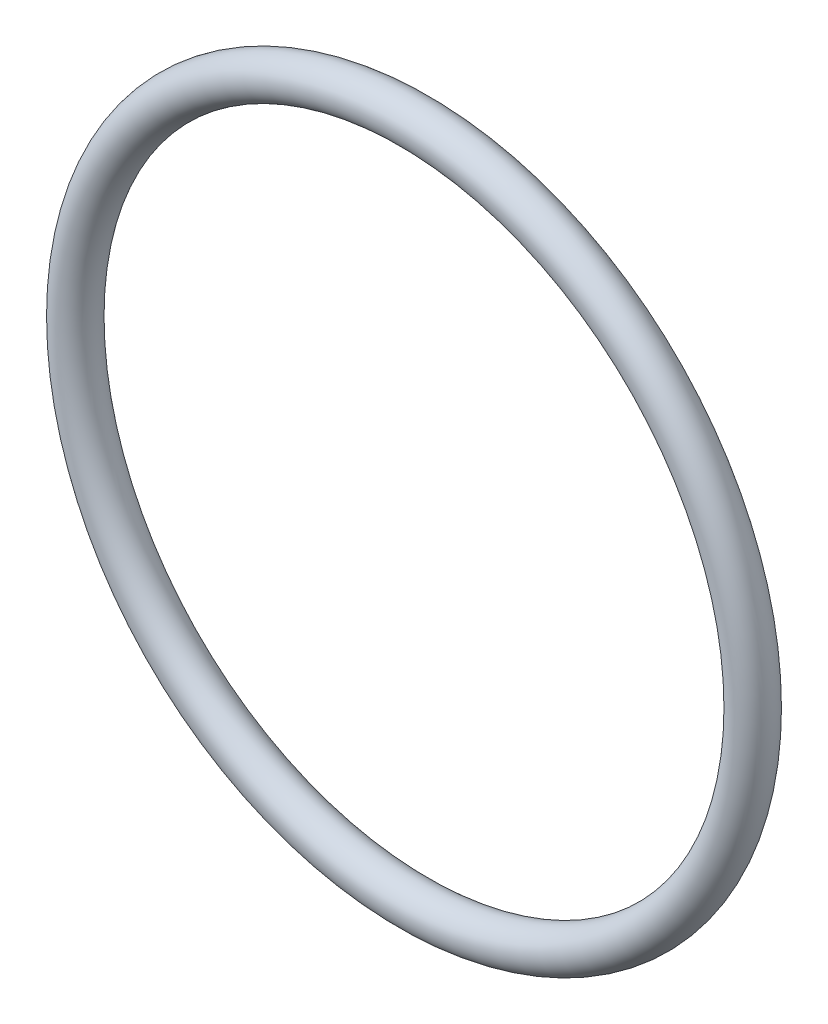
from build123d import *

# Parameters (mm, degrees)
SKETCH1_R = 1.3081


with BuildPart() as part:
    # Sketch1 → Revolve1 (revolve)
    with BuildSketch(Plane(origin=(0, 0, 0), x_dir=(0, -1, 0), z_dir=(1, 0, 0))):
        with Locations((21.7805, 0)):
            Circle(SKETCH1_R)
    revolve(axis=Axis((0, 0, 1.3081), (0, 0, -1)))


solid = part.part
